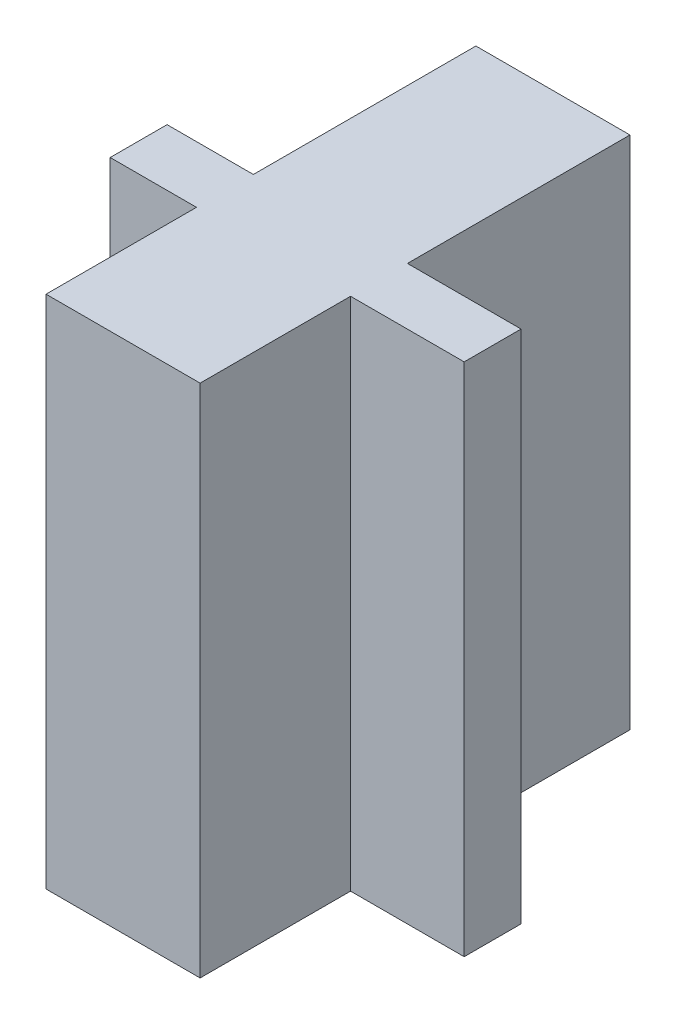
from build123d import *

# Parameters (mm, degrees)
BOSS_EXTRUDE1_DEPTH = 2070.1


with BuildPart() as part:
    # Sketch1 → Boss-Extrude1 (new body)
    with BuildSketch(Plane(origin=(0, 0, 0), x_dir=(1, 0, 0), z_dir=(0, 1, 0))):
        Polygon((254.66284492, 114.3), (711.2, 114.3), (711.2, -114.3), (254.66284492, -114.3), (254.66284492, -718.806417112), (-364.46215508, -718.806417112), (-364.46215508, -114.3), (-711.2, -114.3), (-711.2, 114.3), (-364.46215508, 114.3), (-364.46215508, 1008.393582888), (254.66284492, 1008.393582888), align=None)
    extrude(amount=BOSS_EXTRUDE1_DEPTH)


solid = part.part
